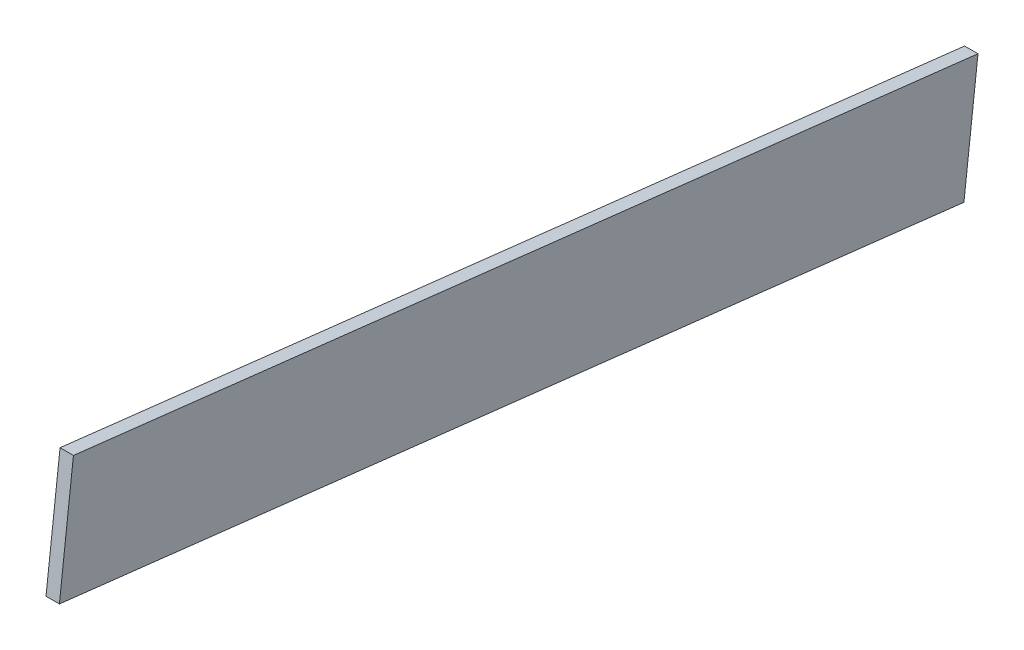
from build123d import *

# Parameters (mm, degrees)
BOSS_EXTRUDE1_DEPTH = 2.5


with BuildPart() as part:
    # Sketch1 → Boss-Extrude1 (new body)
    with BuildSketch(Plane.ZY.offset(223)):
        Polygon((-293.783590574, 362.825494695), (-291.16298503, 340.120839066), (-122.284175449, 359.613085588), (-124.904780993, 382.317741216), align=None)
    extrude(amount=BOSS_EXTRUDE1_DEPTH)


solid = part.part
